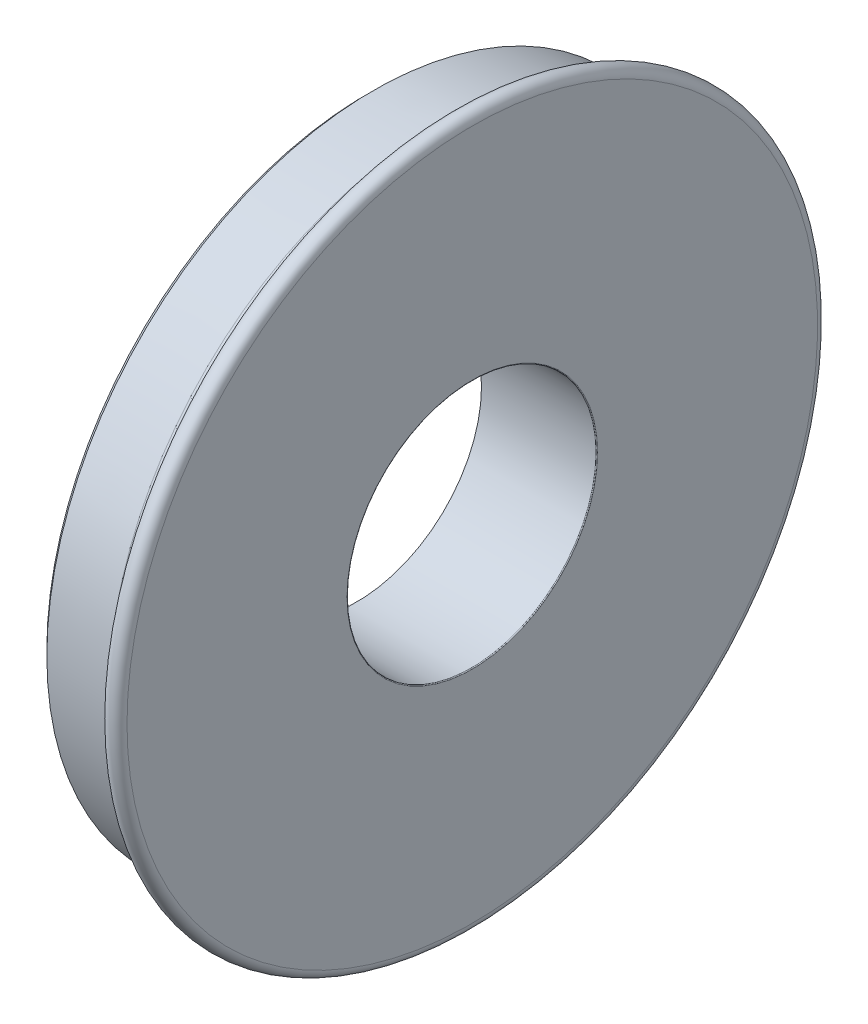
from build123d import *


with BuildPart() as part:
    # Sketch1 → Revolve1 (revolve)
    with BuildSketch(Plane.XY, mode=Mode.PRIVATE) as revolve1_sk:
        with BuildLine():
            Line((0, 37.8), (34.75, 37.8))
            ThreePointArc((34.75, 37.8), (34.926776695, 37.873223305), (35, 38.05))
            Line((35, 38.05), (35, 104.870611348))
            ThreePointArc((35, 104.870611348), (32.419685468, 107.661979883), (29.434472646, 105.308627851))
            Line((29.434472646, 105.308627851), (29.238441703, 104.070937185))
            ThreePointArc((29.238441703, 104.070937185), (27.613100241, 101.108330906), (24.474497484, 99.856155375))
            Line((24.474497484, 99.856155375), (4.957894968, 99.174620597))
            Line((4.957894968, 99.174620597), (3.3, 97.516725629))
            Line((3.3, 97.516725629), (3.3, 79.416725629))
            Line((3.3, 79.416725629), (13.3, 79.416725629))
            Line((13.3, 79.416725629), (13.3, 49.14))
            Line((13.3, 49.14), (0, 49.14))
            Line((0, 49.14), (0, 37.8))
        make_face()
    revolve(revolve1_sk.sketch.rotate(Axis((-146.164683843, 0, 0), (1, 0, 0)), 90), axis=Axis((-146.164683843, 0, 0), (1, 0, 0)))


solid = part.part
